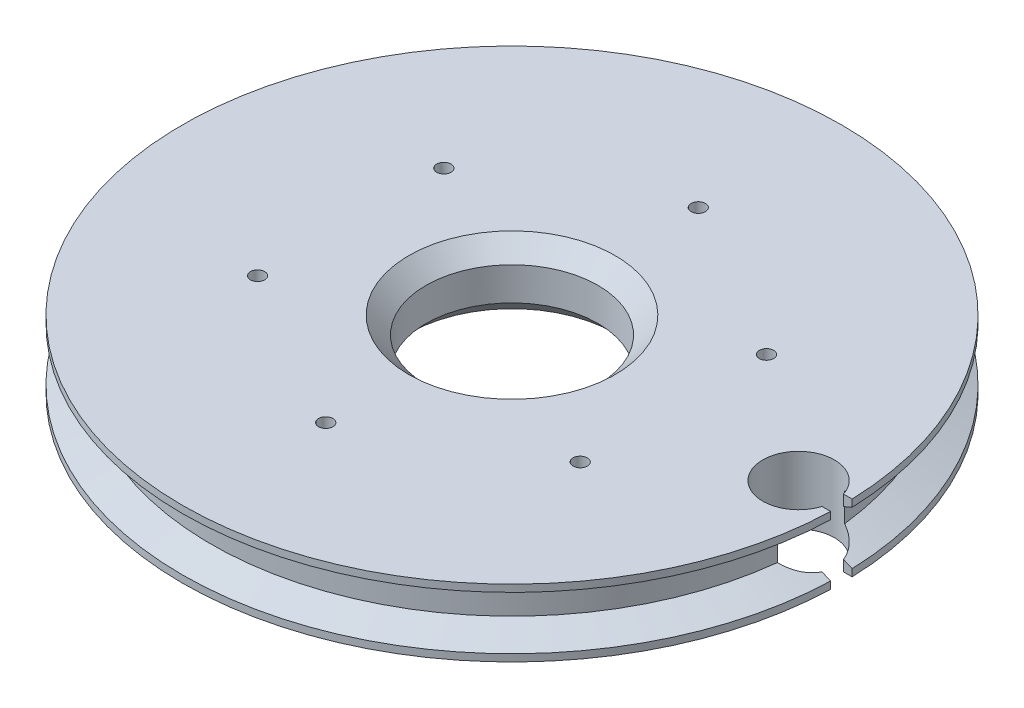
from build123d import *

# Parameters (mm, degrees)
CORTE_EXTRUS_O1_DEPTH      = 10
CHANFRO3_SIZE              = 1.2
CORTE_EXTRUS_O2_DEPTH      = 33.865482391
CORTE_EXTRUS_O2_DEPTH_BACK = 33.865482391
ESBO_O5_R                  = 0.5


with BuildPart() as part:
    # Esboço2 → Revolução1 (revolve)
    with BuildSketch(Plane.XY, mode=Mode.PRIVATE) as revolu_o1_sk:
        Polygon((6, 0), (23, 0), (23, 0.5), (21, 1.352653961), (21, 3.352653961), (23, 4.205307923), (23, 4.705307923), (6, 4.705307923), align=None)
    revolve(revolu_o1_sk.sketch.rotate(Axis((0, 0, 0), (0, 1, 0)), 90), axis=Axis((0, 0, 0), (0, 1, 0)))

    # Esboço3 → Corte-extrusão1 (cut)
    with BuildSketch(Plane.XZ):
        with BuildLine():
            Line((23.115047023, 0.75), (23.115047023, -0.75))
            Line((23.115047023, -0.75), (22.384848004, -0.75))
            ThreePointArc((22.384848004, -0.75), (17.5, 0), (22.384848004, 0.75))
            Line((22.384848004, 0.75), (23.115047023, 0.75))
        make_face()
    extrude(amount=-CORTE_EXTRUS_O1_DEPTH, mode=Mode.SUBTRACT)

    # Chanfro3
    chanfro3_edges = [part.edges().sort_by_distance(p)[0] for p in [
        (0, 0, 6),
        (0, 4.705307923, 6),
    ]]
    chamfer(chanfro3_edges, length=CHANFRO3_SIZE)

    # Esboço5 → Corte-extrusão2 (cut, two sides: drawn at the far end of the back side and taken through both)
    with BuildSketch(Plane(origin=(0, 4.705307923, 0), x_dir=(1, 0, 0), z_dir=(0, 1, 0)).offset(-CORTE_EXTRUS_O2_DEPTH_BACK)):
        with Locations(Location((0, 13, 0), (0, 0, 270))):
            Circle(ESBO_O5_R)
        with Locations(Location((0, -13, 0), (0, 0, 270))):
            Circle(ESBO_O5_R)
        with Locations(Location((11.258330249, 6.5, 0), (0, 0, 270))):
            Circle(ESBO_O5_R)
        with Locations(Location((-11.258330249, -6.5, 0), (0, 0, 270))):
            Circle(ESBO_O5_R)
        with Locations(Location((11.258330249, -6.5, 0), (0, 0, 270))):
            Circle(ESBO_O5_R)
        with Locations(Location((-11.258330249, 6.5, 0), (0, 0, 270))):
            Circle(ESBO_O5_R)
    extrude(amount=CORTE_EXTRUS_O2_DEPTH + CORTE_EXTRUS_O2_DEPTH_BACK, mode=Mode.SUBTRACT)


solid = part.part
